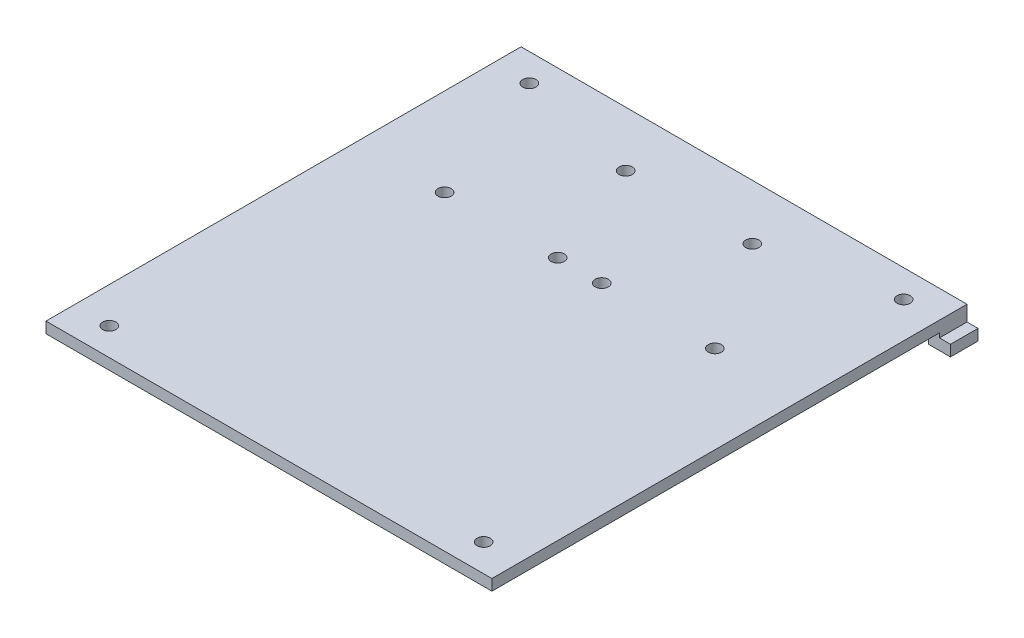
from build123d import *

# Parameters (mm, degrees)
SKETCH_1_W          = 81
SKETCH_1_H          = 86.3
EXTRUDE_1_DEPTH     = 2
SKETCH_2_R          = 1.2
CUT_EXTRUDE_1_DEPTH = 2
SKETCH_3_W          = 2
SKETCH_3_H          = 5
EXTRUDE_2_DEPTH     = 0.8
SKETCH_4_W          = 4
SKETCH_4_H          = 5
EXTRUDE_3_DEPTH     = 2


with BuildPart() as part:
    # ｽｹｯﾁ1 → ﾎﾞｽ - 押し出し1 (new body)
    with BuildSketch(Plane(origin=(0, 0, 0), x_dir=(1, 0, 0), z_dir=(0, 1, 0))):
        Rectangle(SKETCH_1_W, SKETCH_1_H)
    extrude(amount=EXTRUDE_1_DEPTH)

    # ｽｹｯﾁ2 → ｶｯﾄ - 押し出し1 (cut)
    with BuildSketch(Plane(origin=(0, 2, 0), x_dir=(1, 0, 0), z_dir=(0, 1, 0))):
        with Locations(Location((-34, -38.15, 0), (0, 0, 270))):
            Circle(SKETCH_2_R)
        with Locations(Location((-34, 38.15, 0), (0, 0, 270))):
            Circle(SKETCH_2_R)
        with Locations(Location((34, 38.15, 0), (0, 0, 270))):
            Circle(SKETCH_2_R)
        with Locations(Location((34, -38.15, 0), (0, 0, 270))):
            Circle(SKETCH_2_R)
        with Locations(Location((-24.55, 13.3, 0), (0, 0, 270))):
            Circle(SKETCH_2_R)
        with Locations(Location((24.55, 13.3, 0), (0, 0, 270))):
            Circle(SKETCH_2_R)
        with Locations(Location((-11.5, 33.15, 0), (0, 0, 270))):
            Circle(SKETCH_2_R)
        with Locations(Location((11.5, 33.15, 0), (0, 0, 270))):
            Circle(SKETCH_2_R)
        with Locations(Location((-4, 13.3, 0), (0, 0, 270))):
            Circle(SKETCH_2_R)
        with Locations(Location((4, 13.3, 0), (0, 0, 270))):
            Circle(SKETCH_2_R)
    extrude(amount=-CUT_EXTRUDE_1_DEPTH, mode=Mode.SUBTRACT)

    # ｽｹｯﾁ3 → ﾎﾞｽ - 押し出し2 (add)
    with BuildSketch(Plane.XZ):
        with Locations((-39.5, -40.65)):
            Rectangle(SKETCH_3_W, SKETCH_3_H)
        with Locations((39.5, -40.65)):
            Rectangle(SKETCH_3_W, SKETCH_3_H)
    extrude(amount=EXTRUDE_2_DEPTH)

    # ｽｹｯﾁ4 → ﾎﾞｽ - 押し出し3 (add)
    with BuildSketch(Plane.XZ.offset(0.8)):
        with Locations((-40.5, -40.65)):
            Rectangle(SKETCH_4_W, SKETCH_4_H)
        with Locations((40.5, -40.65)):
            Rectangle(SKETCH_4_W, SKETCH_4_H)
    extrude(amount=EXTRUDE_3_DEPTH)


solid = part.part
